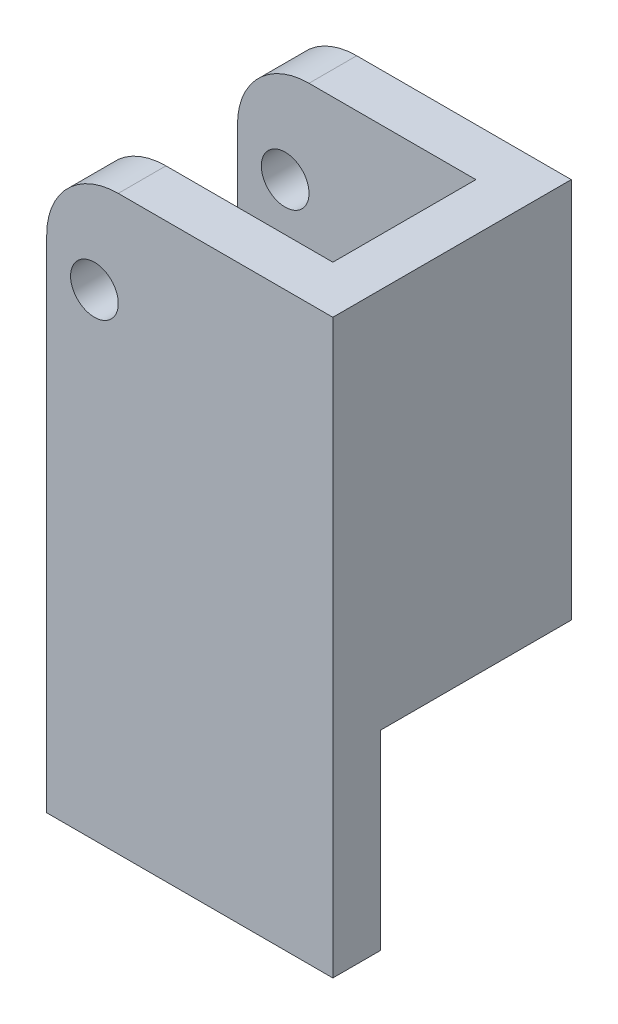
from build123d import *

# Parameters (mm, degrees)
SKETCH1_W           = 38.1
SKETCH1_H           = 76.2
BOSS_EXTRUDE1_DEPTH = 31.75
SKETCH3_W           = 25.4
SKETCH3_H           = 76.2
CUT_EXTRUDE2_DEPTH  = 31.75
SKETCH4_W           = 25.4
SKETCH4_H           = 25.4
CUT_EXTRUDE3_DEPTH  = 89.44526556
SKETCH5_W           = 31.75
SKETCH5_H           = 6.35
BOSS_EXTRUDE2_DEPTH = 50.8
SKETCH6_R           = 3.175
CUT_EXTRUDE4_DEPTH  = 50.8
FILLET2_R           = 9.525
SKETCH7_W           = 31.75
SKETCH7_H           = 19.05
BOSS_EXTRUDE3_DEPTH = 6.35


with BuildPart() as part:
    # Sketch1 → Boss-Extrude1 (new body)
    with BuildSketch(Plane.XY):
        with Locations((19.05, 38.1)):
            Rectangle(SKETCH1_W, SKETCH1_H)
    extrude(amount=-BOSS_EXTRUDE1_DEPTH)

    # Sketch3 → Cut-Extrude2 (cut)
    with BuildSketch(Plane.ZY):
        with Locations((-19.05, 38.1)):
            Rectangle(SKETCH3_W, SKETCH3_H)
    extrude(amount=-CUT_EXTRUDE2_DEPTH, mode=Mode.SUBTRACT)

    # Sketch4 → Cut-Extrude3 (cut, through all)
    with BuildSketch(Plane.ZY.offset(-31.75)):
        with Locations((-19.05, 12.7)):
            Rectangle(SKETCH4_W, SKETCH4_H)
    extrude(amount=-CUT_EXTRUDE3_DEPTH, mode=Mode.SUBTRACT)

    # Sketch5 → Boss-Extrude2 (add)
    with BuildSketch(Plane(origin=(0, 76.2, 0), x_dir=(1, 0, 0), z_dir=(0, 1, 0))):
        with Locations((15.875, 28.575)):
            Rectangle(SKETCH5_W, SKETCH5_H)
    extrude(amount=-BOSS_EXTRUDE2_DEPTH)

    # Sketch6 → Cut-Extrude4 (cut)
    with BuildSketch(Plane(origin=(0, 0, -31.75), x_dir=(-1, 0, 0), z_dir=(0, 0, -1))):
        with Locations((-6.35, 63.5)):
            Circle(SKETCH6_R)
    extrude(amount=-CUT_EXTRUDE4_DEPTH, mode=Mode.SUBTRACT)

    # Fillet2
    fillet2_edges = [part.edges().sort_by_distance(p)[0] for p in [
        (0, 76.2, -3.175),
        (0, 76.2, -28.575),
    ]]
    fillet(fillet2_edges, radius=FILLET2_R)

    # Sketch7 → Boss-Extrude3 (add)
    with BuildSketch(Plane(origin=(0, 25.4, 0), x_dir=(-1, 0, 0), z_dir=(0, -1, 0))):
        with Locations((-15.875, 15.875)):
            Rectangle(SKETCH7_W, SKETCH7_H)
    extrude(amount=-BOSS_EXTRUDE3_DEPTH)


solid = part.part
